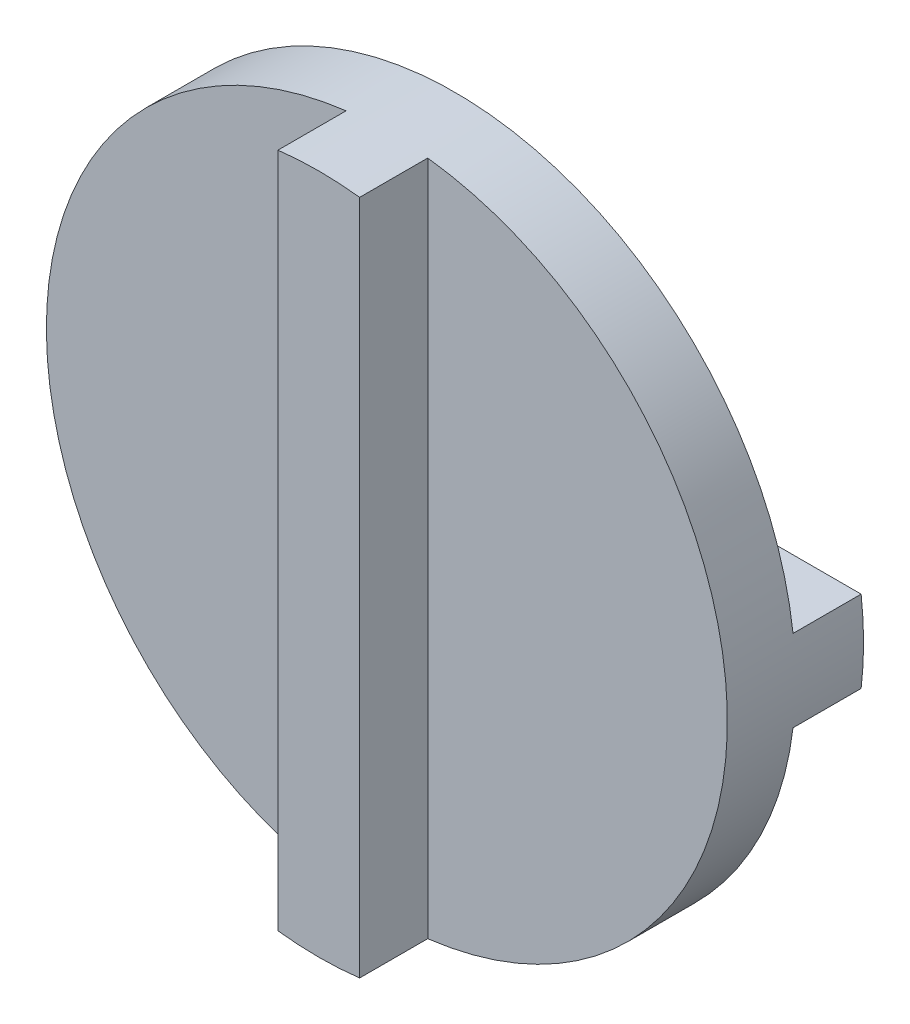
from build123d import *

# Parameters (mm, degrees)
SKETCH2_R           = 50
BOSS_EXTRUDE1_DEPTH = 10
BOSS_EXTRUDE2_START = 10
BOSS_EXTRUDE2_DEPTH = 10
BOSS_EXTRUDE3_DEPTH = 10


with BuildPart() as part:
    # Sketch2 → Boss-Extrude1 (new body)
    with BuildSketch(Plane.XY):
        Circle(SKETCH2_R)
    extrude(amount=BOSS_EXTRUDE1_DEPTH)

    # Sketch3 → Boss-Extrude2 (add)
    with BuildSketch(Plane(origin=(0, 0, 0), x_dir=(-1, 0, 0), z_dir=(0, 0, -1)).offset(BOSS_EXTRUDE2_START)):
        with BuildLine():
            Line((-49.638694584, 6), (49.638694584, 6))
            ThreePointArc((49.638694584, 6), (50, 0), (49.638694584, -6))
            Line((49.638694584, -6), (-49.638694584, -6))
            ThreePointArc((-49.638694584, -6), (-50, 0), (-49.638694584, 6))
        make_face()
    extrude(amount=-BOSS_EXTRUDE2_DEPTH)

    # Sketch5 → Boss-Extrude3 (add)
    with BuildSketch(Plane.XY.offset(10)):
        with BuildLine():
            Line((-6, 49.638694584), (-6, -49.638694584))
            ThreePointArc((-6, -49.638694584), (0, -50), (6, -49.638694584))
            Line((6, -49.638694584), (6, 49.638694584))
            ThreePointArc((6, 49.638694584), (0, 50), (-6, 49.638694584))
        make_face()
    extrude(amount=BOSS_EXTRUDE3_DEPTH)


solid = part.part
